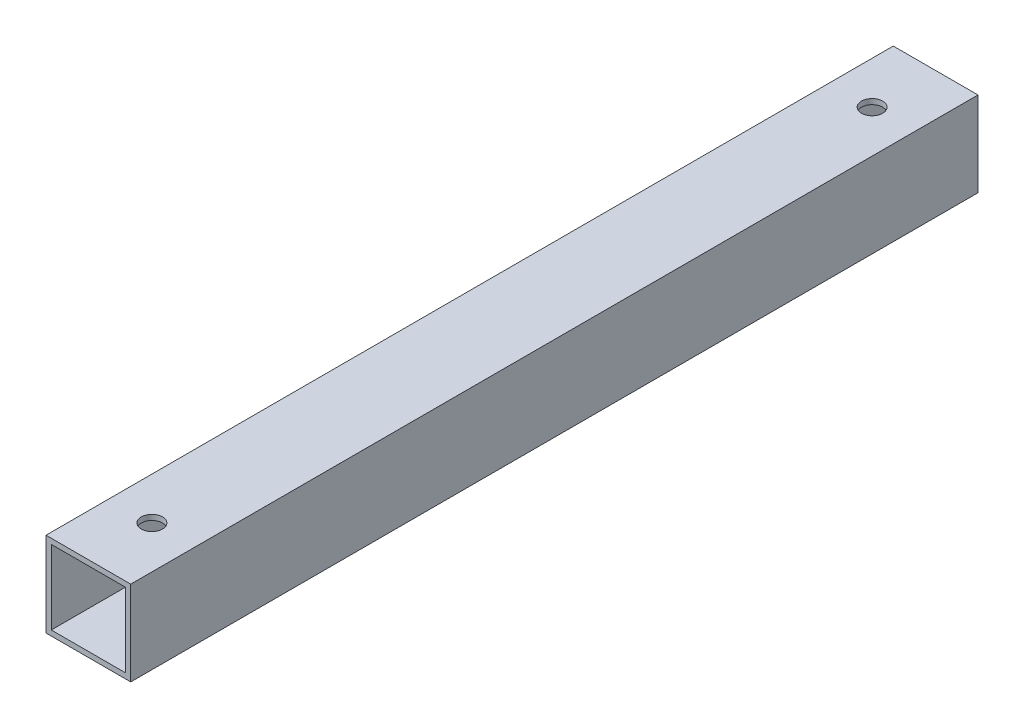
from build123d import *

# Parameters (mm, degrees)
SKETCH1_W           = 25.4
SKETCH1_H           = 25.4
SKETCH1_W_2         = 22.225
SKETCH1_H_2         = 22.225
BOSS_EXTRUDE1_DEPTH = 254
SKETCH2_R           = 3.175
CUT_EXTRUDE1_DEPTH  = 256.582569828


with BuildPart() as part:
    # Sketch1 → Boss-Extrude1 (new body)
    with BuildSketch(Plane.XY):
        Rectangle(SKETCH1_W, SKETCH1_H)
        Rectangle(SKETCH1_W_2, SKETCH1_H_2, mode=Mode.SUBTRACT)
    extrude(amount=BOSS_EXTRUDE1_DEPTH)

    # Sketch2 → Cut-Extrude1 (cut, through all)
    with BuildSketch(Plane(origin=(0, 12.7, 0), x_dir=(1, 0, 0), z_dir=(0, 1, 0))):
        with Locations(Location((0, -19.05, 0), (0, 0, 270))):
            Circle(SKETCH2_R)
        with Locations(Location((0, -234.95, 0), (0, 0, 270))):
            Circle(SKETCH2_R)
    extrude(amount=-CUT_EXTRUDE1_DEPTH, mode=Mode.SUBTRACT)


solid = part.part
